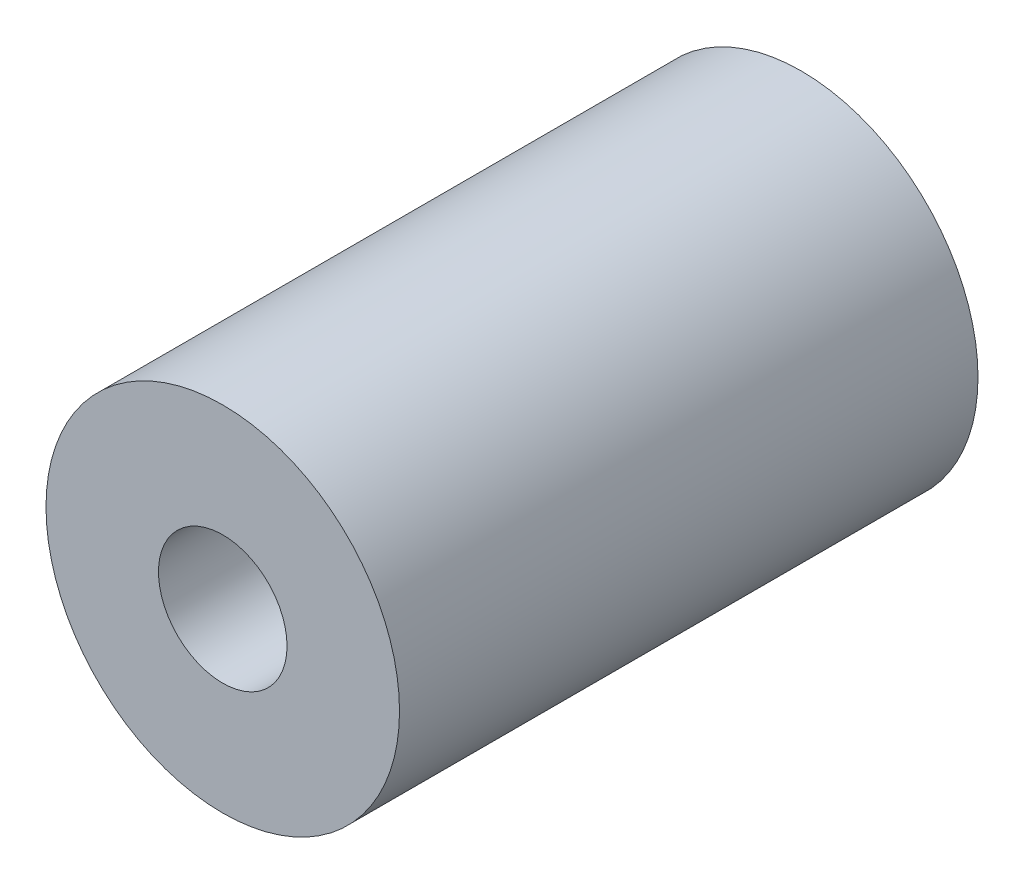
from build123d import *

# Parameters (mm, degrees)
SKETCH1_R           = 11
SKETCH1_R_2         = 4
BOSS_EXTRUDE1_DEPTH = 36


with BuildPart() as part:
    # Sketch1 → Boss-Extrude1 (new body)
    with BuildSketch(Plane.XY):
        Circle(SKETCH1_R)
        Circle(SKETCH1_R_2, mode=Mode.SUBTRACT)
    extrude(amount=BOSS_EXTRUDE1_DEPTH)


solid = part.part
